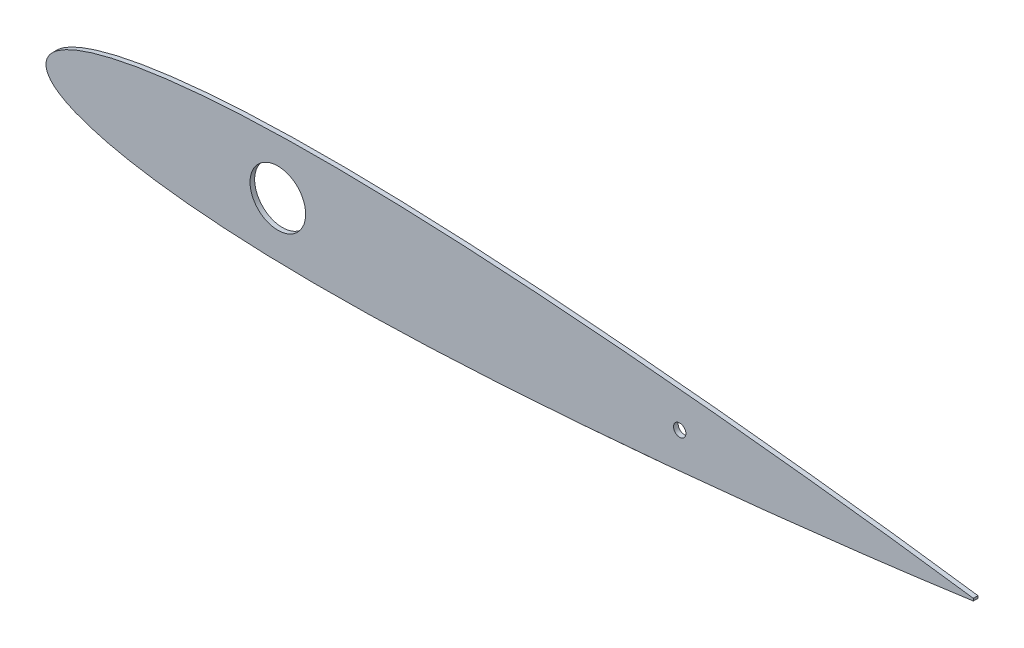
from build123d import *

# Parameters (mm, degrees)
BOSS_EXTRUDE1_DEPTH = 1.5
SKETCH7_R           = 9
CUT_EXTRUDE7_DEPTH  = 301.543472003
SKETCH13_R          = 2
CUT_EXTRUDE11_DEPTH = 301.543472003


with BuildPart() as part:
    # Sketch5 → Boss-Extrude1 (new body)
    with BuildSketch(Plane.XY):
        with BuildLine():
            Line((300, 0.378), (300, -0.378))
            add(Edge.make_bspline(
                [(300, 0.378), (299.270406424, 0.479445822), (297.234667094, 0.762503754), (293.659650161, 1.257673506), (289.112411795, 1.874242443), (284.080816659, 2.54451744), (278.752044218, 3.238122316), (273.265899022, 3.934946436), (267.705955472, 4.629019943), (262.11456302, 5.313069107), (256.508348909, 5.982191812), (250.891738994, 6.637990809), (245.269556965, 7.281779235), (239.647345349, 7.912232764), (234.025130107, 8.526992046), (228.399087903, 9.126229764), (222.768257645, 9.713077606), (217.135920793, 10.28745981), (211.505410154, 10.846941084), (205.877619803, 11.391642827), (200.251512374, 11.920884624), (194.626420536, 12.434617078), (189.002797137, 12.931911809), (183.381530938, 13.413097581), (177.763225616, 13.876376701), (172.148301533, 14.321237194), (166.537529462, 14.747820918), (160.931736194, 15.154228144), (155.33170885, 15.539100856), (149.737538345, 15.902649564), (144.148688279, 16.241846119), (138.565679604, 16.557420546), (132.990859803, 16.847397555), (127.42743944, 17.110211679), (121.877619637, 17.343891718), (116.340758577, 17.545256813), (110.815476382, 17.71267912), (105.301273398, 17.844497938), (99.800570116, 17.940091813), (94.317435844, 17.996590439), (88.855764067, 18.010124458), (83.418647975, 17.97923384), (78.008480827, 17.899160713), (72.628455365, 17.767033787), (67.282738746, 17.579413934), (61.977364895, 17.331515489), (56.720691016, 17.021032651), (51.525175322, 16.64095807), (46.408202619, 16.190188591), (41.394176065, 15.661669099), (36.515671087, 15.053963784), (31.819009441, 14.365623605), (27.366164829, 13.603475684), (23.235217954, 12.782583444), (19.502642451, 11.920250751), (16.218271393, 11.044597796), (13.389186016, 10.175076255), (10.984929333, 9.333498715), (8.961561478, 8.522062882), (7.267292053, 7.746976002), (5.846052466, 7.010625622), (4.647711085, 6.300634033), (3.628235251, 5.606513668), (2.751909197, 4.926635252), (2.00625736, 4.249917259), (1.390586137, 3.570259492), (0.901000435, 2.890942252), (0.529275535, 2.220219273), (0.260479537, 1.566458936), (0.085712654, 0.931035928), (-0.003509247, 0.308981015), (-0.003509247, -0.308981015), (0.085712654, -0.931035928), (0.260479537, -1.566458936), (0.529275535, -2.220219273), (0.901000435, -2.890942252), (1.390586137, -3.570259492), (2.00625736, -4.249917259), (2.751909197, -4.926635252), (3.628235251, -5.606513668), (4.647711085, -6.300634033), (5.846052466, -7.010625622), (7.267292053, -7.746975999), (8.961561475, -8.522062895), (10.984929344, -9.333498651), (13.389185965, -10.175076559), (16.21827163, -11.044596377), (19.502641361, -11.92025728), (23.235222799, -12.782554413), (27.366127559, -13.603596161), (31.819075008, -14.365113363), (36.515634637, -15.054106097), (41.394182204, -15.661628887), (46.408200924, -16.190199694), (51.525175786, -16.640955027), (56.720690889, -17.02103348), (61.977364929, -17.331515263), (67.282738736, -17.579413995), (72.628455367, -17.767033771), (78.008480826, -17.899160717), (83.418647975, -17.979233839), (88.855764067, -18.010124458), (94.317435844, -17.996590438), (99.800570116, -17.940091813), (105.301273398, -17.844497938), (110.815476382, -17.71267912), (116.340758577, -17.545256813), (121.877619637, -17.343891718), (127.42743944, -17.110211679), (132.990859803, -16.847397555), (138.565679604, -16.557420546), (144.148688279, -16.241846119), (149.737538345, -15.902649564), (155.33170885, -15.539100856), (160.931736194, -15.154228144), (166.537529462, -14.747820918), (172.148301533, -14.321237194), (177.763225616, -13.876376701), (183.381530938, -13.413097581), (189.002797137, -12.931911809), (194.626420536, -12.434617078), (200.251512374, -11.920884624), (205.877619803, -11.391642827), (211.505410154, -10.846941084), (217.135920793, -10.28745981), (222.768257645, -9.713077606), (228.399087903, -9.126229764), (234.025130107, -8.526992046), (239.647345349, -7.912232764), (245.269556965, -7.281779235), (250.891738994, -6.637990809), (256.508348909, -5.982191812), (262.11456302, -5.313069107), (267.705955472, -4.629019943), (273.265899022, -3.934946436), (278.752044218, -3.238122316), (284.080816659, -2.54451744), (289.112411795, -1.874242443), (293.659650161, -1.257673506), (297.234667094, -0.762503754), (299.270406424, -0.479445822), (300, -0.378)],
                knots=[0, 0, 0, 0, 0.003612221, 0.010078953, 0.017698618, 0.026115111, 0.034970966, 0.04405038, 0.05323433, 0.06244757, 0.071673993, 0.080921319, 0.090177538, 0.099424342, 0.108664441, 0.117912199, 0.127169502, 0.136426595, 0.145675426, 0.154916495, 0.164153237, 0.173386649, 0.182615736, 0.191838089, 0.201053134, 0.210260393, 0.219458942, 0.228646747, 0.237822316, 0.246985224, 0.256137384, 0.265279416, 0.27440695, 0.283512193, 0.292591781, 0.301646285, 0.310681793, 0.319699068, 0.32869452, 0.33766016, 0.346588583, 0.355477412, 0.364322937, 0.373121614, 0.381867635, 0.390553005, 0.399166026, 0.407689628, 0.416098119, 0.424354887, 0.432412429, 0.440204728, 0.447630505, 0.454563638, 0.460855379, 0.466413319, 0.47122861, 0.475365774, 0.47890126, 0.481915077, 0.484498872, 0.486747127, 0.488741252, 0.490543179, 0.492182104, 0.493672831, 0.495031908, 0.49627906, 0.497424737, 0.498490166, 0.499502758, 0.500497254, 0.501509846, 0.502575275, 0.503720952, 0.504968104, 0.506327181, 0.507817908, 0.509456832, 0.51125876, 0.513252884, 0.51550114, 0.518084934, 0.521098752, 0.524634237, 0.528771401, 0.533586692, 0.539144632, 0.545436374, 0.552369506, 0.5597952, 0.567587571, 0.575645113, 0.583901881, 0.592310372, 0.600833974, 0.609446995, 0.618132365, 0.626878386, 0.635677063, 0.644522588, 0.653411417, 0.66233984, 0.67130548, 0.680300932, 0.689318207, 0.698353715, 0.707408219, 0.716487807, 0.72559305, 0.734720584, 0.743862616, 0.753014776, 0.762177684, 0.771353253, 0.780541058, 0.789739607, 0.798946866, 0.808161911, 0.817384264, 0.826613351, 0.835846763, 0.845083505, 0.854324574, 0.863573405, 0.872830498, 0.882087801, 0.891335559, 0.900575658, 0.909822462, 0.919078681, 0.928326007, 0.93755243, 0.94676567, 0.95594962, 0.965029034, 0.973884889, 0.982301382, 0.989921047, 0.996387779, 1, 1, 1, 1], degree=3))
        make_face()
    extrude(amount=BOSS_EXTRUDE1_DEPTH)

    # Sketch7 → Cut-Extrude7 (cut, through all)
    with BuildSketch(Plane.XY.offset(1.5)):
        with Locations((75, 0)):
            Circle(SKETCH7_R)
    extrude(amount=-CUT_EXTRUDE7_DEPTH, mode=Mode.SUBTRACT)

    # Sketch13 → Cut-Extrude11 (cut, through all)
    with BuildSketch(Plane.XY):
        with Locations((205, 0)):
            Circle(SKETCH13_R)
    extrude(amount=CUT_EXTRUDE11_DEPTH, mode=Mode.SUBTRACT)


solid = part.part
